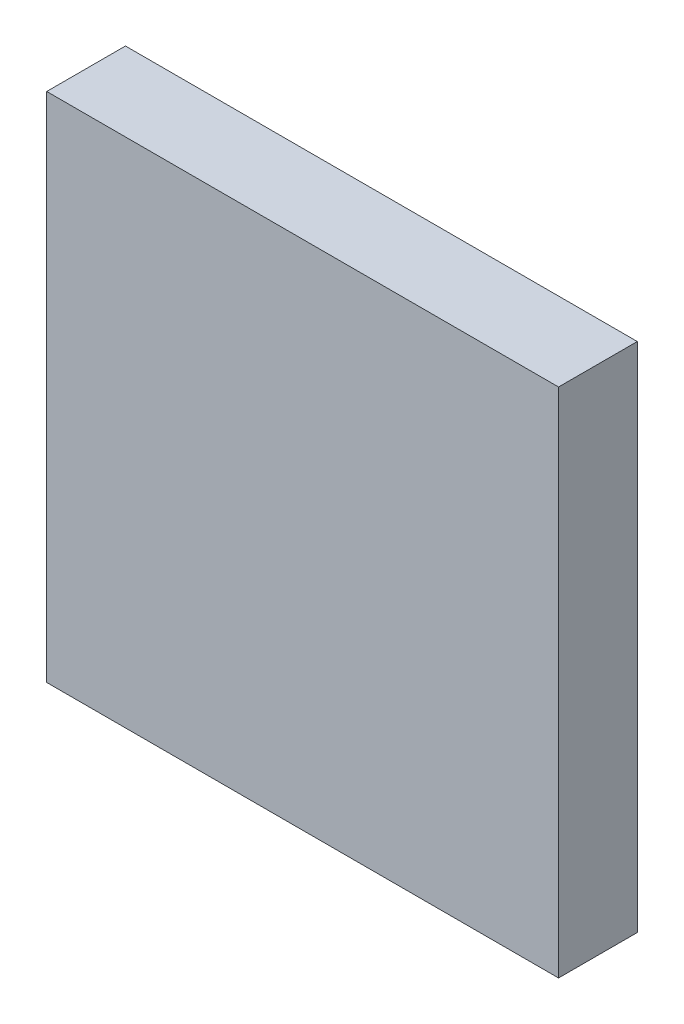
from build123d import *

# Parameters (mm, degrees)
ESQUISSE1_W        = 82.55
ESQUISSE1_H        = 82.55
BOSS_EXTRU_1_DEPTH = 12.7


with BuildPart() as part:
    # Esquisse1 → Boss.-Extru.1 (new body)
    with BuildSketch(Plane.XY):
        Rectangle(ESQUISSE1_W, ESQUISSE1_H)
    extrude(amount=BOSS_EXTRU_1_DEPTH)


solid = part.part
